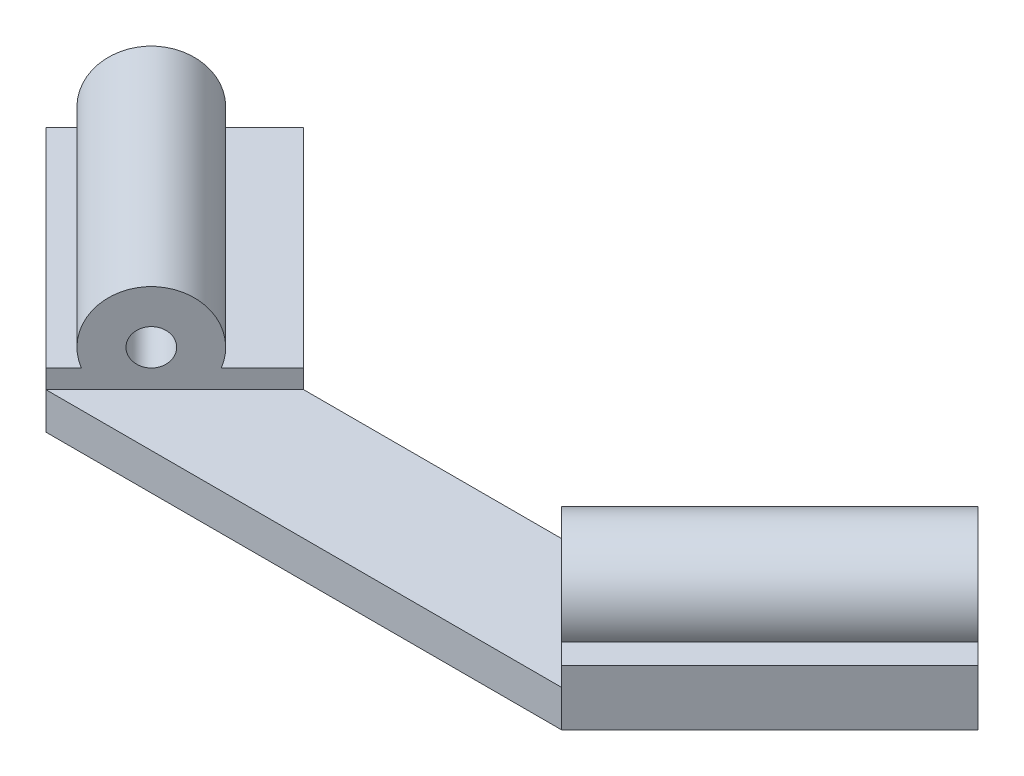
from build123d import *

# Parameters (mm, degrees)
BOSS_EXTRUDE1_START = 4
BOSS_EXTRUDE1_DEPTH = 5
ANTENNAHOLSTER1_R   = 2.43625
BOSS_EXTRUDE2_DEPTH = 40
ANTENNAHOLSTER2_R   = 2.43625
BOSS_EXTRUDE3_DEPTH = 40


with BuildPart() as part:
    # Trapezoid1 → Boss-Extrude1 (new body)
    with BuildSketch(Plane(origin=(0, 0, 0), x_dir=(1, 0, 0), z_dir=(0, 1, 0)).offset(BOSS_EXTRUDE1_START)):
        Polygon((-114.335639632, -37.176097112), (-96.835639632, -19.676097112), (-61.835639632, -19.676097112), (-44.335639632, -37.176097112), align=None)
    extrude(amount=BOSS_EXTRUDE1_DEPTH)

    # AntennaHolster1 → Boss-Extrude2 (add)
    with BuildSketch(Plane(origin=(-40.755868372, 0, 40.755868372), x_dir=(-0.7071067811865513, 0, -0.7071067811865438), z_dir=(0.7071067811865438, 0, -0.7071067811865513))):
        with BuildLine():
            Line((5.062561066, 11.55), (5.062561066, 4))
            Line((5.062561066, 4), (29.811298407, 4))
            Line((29.811298407, 4), (29.811298407, 11.55))
            Line((29.811298407, 11.55), (22.423126617, 11.55))
            ThreePointArc((22.423126617, 11.55), (15.707633336, 21.13), (8.992140056, 11.55))
            Line((8.992140056, 11.55), (5.062561066, 11.55))
        make_face()
        with Locations((15.707633336, 13.98625)):
            Circle(ANTENNAHOLSTER1_R, mode=Mode.SUBTRACT)
    extrude(amount=BOSS_EXTRUDE2_DEPTH)

    # AntennaHolster2 → Boss-Extrude3 (add)
    with BuildSketch(Plane(origin=(-38.57977126, 0, -38.57977126), x_dir=(-0.7071067811865462, 0, 0.7071067811865489), z_dir=(-0.7071067811865489, 0, -0.7071067811865462))):
        with BuildLine():
            Line((82.38623914, 11.55), (82.38623914, 4))
            Line((82.38623914, 4), (107.134976481, 4))
            Line((107.134976481, 4), (107.134976481, 11.55))
            Line((107.134976481, 11.55), (103.736913224, 11.55))
            ThreePointArc((103.736913224, 11.55), (97.021419943, 21.13), (90.305926663, 11.55))
            Line((90.305926663, 11.55), (82.38623914, 11.55))
        make_face()
        with Locations((97.021419943, 13.98625)):
            Circle(ANTENNAHOLSTER2_R, mode=Mode.SUBTRACT)
    extrude(amount=BOSS_EXTRUDE3_DEPTH)


solid = part.part
